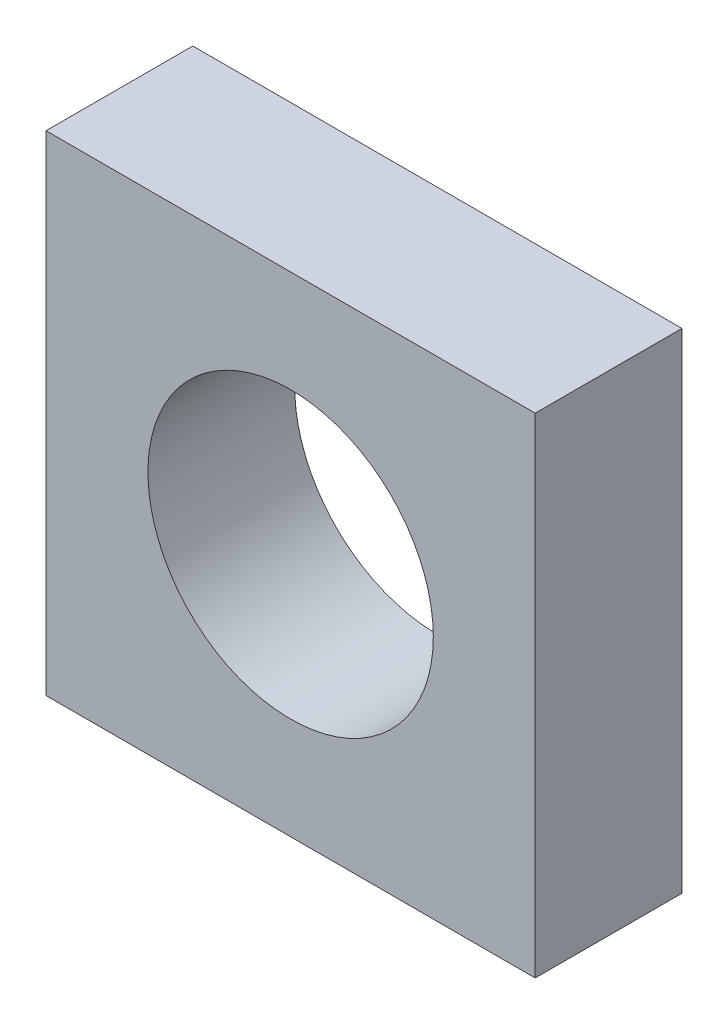
from build123d import *

# Parameters (mm, degrees)
SCHIZZO1_W                   = 6
SCHIZZO1_H                   = 6
SCHIZZO1_R                   = 1.75
ESTRUSIONE_ESTRUSIONE1_DEPTH = 0.9


with BuildPart() as part:
    # Schizzo1 → Estrusione-Estrusione1 (new, symmetric)
    with BuildSketch(Plane.XY):
        Rectangle(SCHIZZO1_W, SCHIZZO1_H)
        Circle(SCHIZZO1_R, mode=Mode.SUBTRACT)
    extrude(amount=ESTRUSIONE_ESTRUSIONE1_DEPTH, both=True)


solid = part.part
